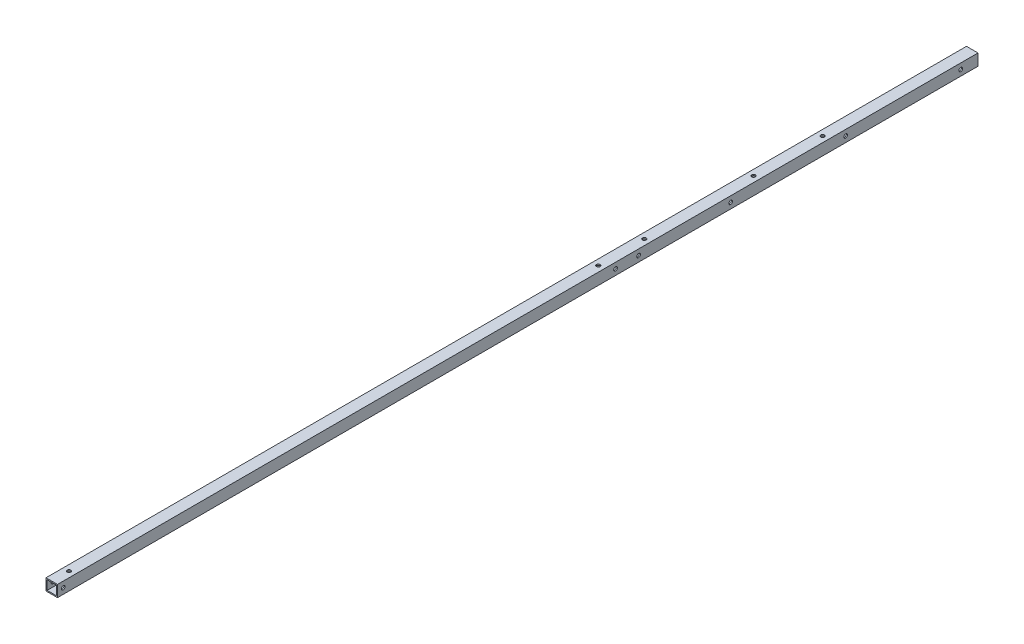
from build123d import *

# Parameters (mm, degrees)
SKETCH_1_W             = 10
SKETCH_1_H             = 10
SKETCH_1_W_2           = 8
SKETCH_1_H_2           = 8
EXTRUDE_1_DEPTH        = 800
SKETCH_3_R             = 1.6
CUT_EXTRUDE_2_DEPTH    = 801.078121186
SKETCH_4_R             = 1.6
CUT_EXTRUDE_3_DEPTH    = 801.078121186
SKETCH_5_R             = 1.6
CUT_EXTRUDE_4_DEPTH    = 801.078121186
PATTERN_LINEAR_1_COUNT = 4
PATTERN_LINEAR_1_PITCH = 100


with BuildPart() as part:
    # ｽｹｯﾁ1 → ﾎﾞｽ - 押し出し1 (new body)
    with BuildSketch(Plane.XY):
        Rectangle(SKETCH_1_W, SKETCH_1_H)
        Rectangle(SKETCH_1_W_2, SKETCH_1_H_2, mode=Mode.SUBTRACT)
    extrude(amount=EXTRUDE_1_DEPTH)

    # ｽｹｯﾁ3 → ｶｯﾄ - 押し出し2 (cut, through all)
    with BuildSketch(Plane(origin=(0, 5, 0), x_dir=(1, 0, 0), z_dir=(0, 1, 0))):
        with Locations(Location((0, -785, 0), (0, 0, 270))):
            Circle(SKETCH_3_R)
        with Locations(Location((0, -190, 0), (0, 0, 270))):
            Circle(SKETCH_3_R)
        with Locations(Location((0, -130, 0), (0, 0, 270))):
            Circle(SKETCH_3_R)
        with Locations(Location((0, -325, 0), (0, 0, 270))):
            Circle(SKETCH_3_R)
        with Locations(Location((0, -285, 0), (0, 0, 270))):
            Circle(SKETCH_3_R)
    extrude(amount=-CUT_EXTRUDE_2_DEPTH, mode=Mode.SUBTRACT)

    # ｽｹｯﾁ4 → ｶｯﾄ - 押し出し3 (cut, through all)
    with BuildSketch(Plane.ZY.offset(5)):
        with Locations((795, 0)):
            Circle(SKETCH_4_R)
        with Locations((295, 0)):
            Circle(SKETCH_4_R)
    extrude(amount=-CUT_EXTRUDE_3_DEPTH, mode=Mode.SUBTRACT)

    # ｽｹｯﾁ5 → ｶｯﾄ - 押し出し4 (cut, through all)
    with BuildSketch(Plane(origin=(5, 0, 0), x_dir=(0, 0, -1), z_dir=(1, 0, 0))):
        with Locations((-15, 0)):
            Circle(SKETCH_5_R)
    cut_extrude_4 = extrude(amount=-CUT_EXTRUDE_4_DEPTH, mode=Mode.SUBTRACT)

    # 直線ﾊﾟﾀｰﾝ1: ｶｯﾄ - 押し出し4 ×4
    with Locations(*[(0, 0, i * PATTERN_LINEAR_1_PITCH) for i in range(1, PATTERN_LINEAR_1_COUNT)]):
        add(cut_extrude_4, mode=Mode.SUBTRACT)


solid = part.part
